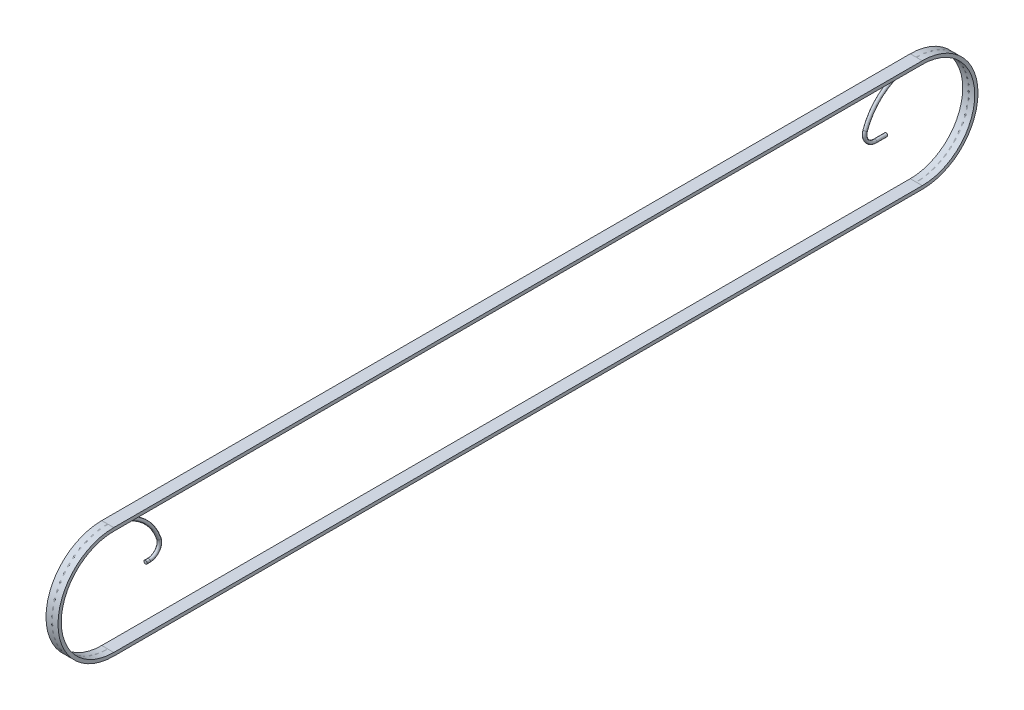
from build123d import *

# Parameters (mm, degrees)
BOSS_EXTRUDE1_DEPTH = 8.73125
SWEEP1_PROFILE_R    = 2.38125


with BuildPart() as part:
    # Sketch1 → Boss-Extrude1 (new, symmetric)
    with BuildSketch(Plane(origin=(0, 0, 0), x_dir=(0, 0, -1), z_dir=(1, 0, 0))):
        with BuildLine():
            Line((0, 80.9625), (1174.668204634, 80.9625))
            ThreePointArc((1174.668204634, 80.9625), (1255.630704634, 0), (1174.668204634, -80.9625))
            Line((1174.668204634, -80.9625), (0, -80.9625))
            ThreePointArc((0, -80.9625), (-80.9625, 0), (0, 80.9625))
        make_face()
        with BuildLine():
            Line((1174.668204634, 76.2), (0, 76.2))
            ThreePointArc((0, 76.2), (-76.2, 0), (0, -76.2))
            Line((0, -76.2), (1174.668204634, -76.2))
            ThreePointArc((1174.668204634, -76.2), (1250.868204634, 0), (1174.668204634, 76.2))
        make_face(mode=Mode.SUBTRACT)
    extrude(amount=BOSS_EXTRUDE1_DEPTH, both=True)


with BuildPart() as body_2:
    # Sweep1: sweep along a path in Sketch2
    with BuildLine(Plane(origin=(0, 0, 0), x_dir=(0, 0, -1), z_dir=(1, 0, 0))) as sweep1_path:
        Line((1130.87336033, 5.55625), (1115.06186033, 5.55625))
        ThreePointArc((1115.06186033, 5.55625), (1102.496733717, 12.053365614), (1100.534685965, 26.062123116))
        ThreePointArc((1100.534685965, 26.062123116), (1238.78921158, 45.425866197), (1174.668204634, -78.58125))
        Line((1174.668204634, -78.58125), (0, -78.58125))
        ThreePointArc((0, -78.58125), (-64.121006946, 45.425866197), (74.133518669, 26.062123116))
        ThreePointArc((74.133518669, 26.062123116), (72.171470917, 12.053365614), (59.606344304, 5.55625))
        Line((59.606344304, 5.55625), (54.843844304, 5.55625))
    # Sweep1 profile (on start of the path) → Sweep1 (sweep)
    with BuildSketch(Plane(origin=(0, 5.55625, -1130.87336033), x_dir=(0, 1, 0), z_dir=(0, 0, 1))):
        Circle(SWEEP1_PROFILE_R)
    sweep(path=sweep1_path.line)


solid = Compound([part.part, body_2.part])
